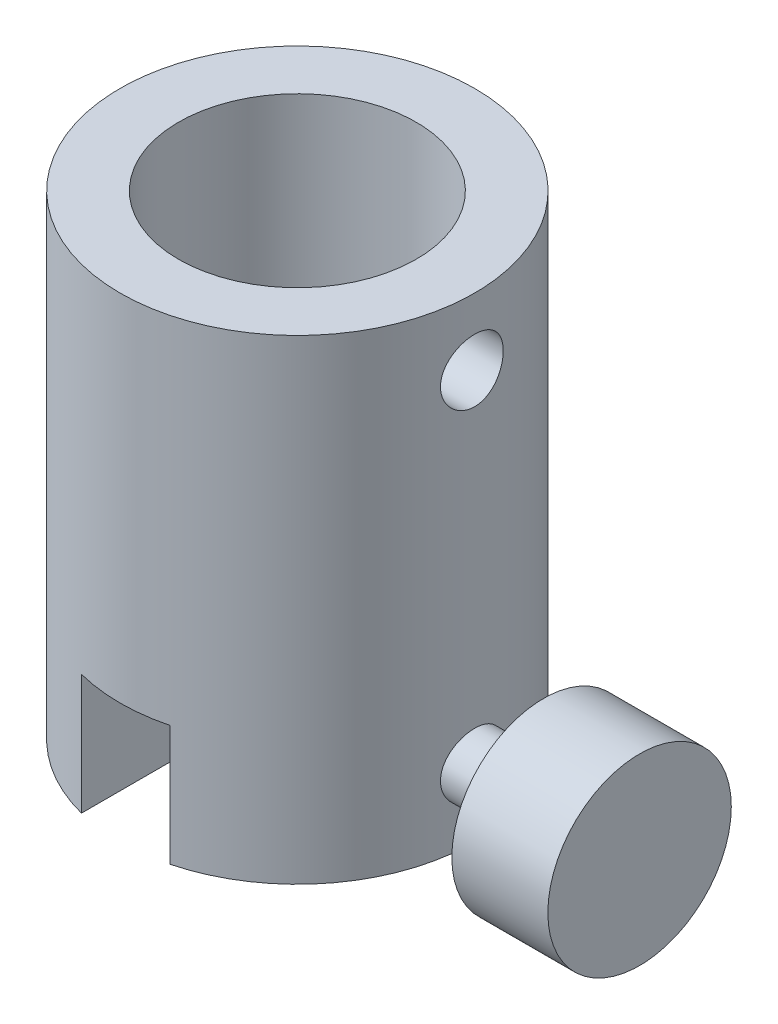
from build123d import *

# Parameters (mm, degrees)
SKETCH1_R               = 9.4742
BOSS_EXTRUDE1_DEPTH     = 25.4
SKETCH2_R               = 6.35
CUT_EXTRUDE1_DEPTH      = 15.9766
CUT_EXTRUDE2_DEPTH      = 29.717258422
CUT_EXTRUDE2_DEPTH_BACK = 29.717258422
CUT_EXTRUDE3_DEPTH      = 29.717258422
CUT_EXTRUDE3_DEPTH_BACK = 29.717258422
SKETCH4_R               = 1.6764
SKETCH5_R               = 1.6764
CUT_EXTRUDE4_DEPTH      = 29.717258577
SKETCH6_R               = 1.6764
BOSS_EXTRUDE2_DEPTH     = 3.683
SKETCH7_R               = 4.9022
BOSS_EXTRUDE3_DEPTH     = 5.1308
SKETCH8_R               = 1.6764
BOSS_EXTRUDE4_DEPTH     = 6.5278


with BuildPart() as part:
    # Sketch1 → Boss-Extrude1 (new body)
    with BuildSketch(Plane(origin=(0, 0, 0), x_dir=(1, 0, 0), z_dir=(0, 1, 0))):
        with Locations(Location((0, 0, 0), (0, 0, 270))):
            Circle(SKETCH1_R)
    extrude(amount=BOSS_EXTRUDE1_DEPTH)

    # Sketch2 → Cut-Extrude1 (cut)
    with BuildSketch(Plane(origin=(0, 25.4, 0), x_dir=(1, 0, 0), z_dir=(0, 1, 0))):
        with Locations(Location((0, 0, 0), (0, 0, 270))):
            Circle(SKETCH2_R)
    extrude(amount=-CUT_EXTRUDE1_DEPTH, mode=Mode.SUBTRACT)

    # Sketch3 → Cut-Extrude2 (cut, two sides: drawn at the far end of the back side and taken through both)
    with BuildSketch(Plane.XY.offset(-CUT_EXTRUDE2_DEPTH_BACK)):
        Polygon((0, 0), (2.3622, 0), (2.3622, 6.4262), (-2.3622, 6.4262), (-2.3622, 0), align=None)
    extrude(amount=CUT_EXTRUDE2_DEPTH + CUT_EXTRUDE2_DEPTH_BACK, mode=Mode.SUBTRACT)

    # Sketch4 → Cut-Extrude3 (cut, two sides: drawn at the far end of the back side and taken through both)
    with BuildSketch(Plane(origin=(0, 0, 0), x_dir=(0, 0, -1), z_dir=(1, 0, 0)).offset(-CUT_EXTRUDE3_DEPTH_BACK)):
        with Locations((0, 3.5814)):
            Circle(SKETCH4_R)
    extrude(amount=CUT_EXTRUDE3_DEPTH + CUT_EXTRUDE3_DEPTH_BACK, mode=Mode.SUBTRACT)

    # Sketch5 → Cut-Extrude4 (cut, through all)
    with BuildSketch(Plane(origin=(0, 0, 0), x_dir=(0, 0, -1), z_dir=(1, 0, 0))):
        with Locations(Location((0, 21.8186, 0), (0, 0, 180))):
            Circle(SKETCH5_R)
    extrude(amount=CUT_EXTRUDE4_DEPTH, mode=Mode.SUBTRACT)



with BuildPart() as body_2:
    # Sketch6 → Boss-Extrude2 (new body)
    with BuildSketch(Plane(origin=(9.4742, 0, 0), x_dir=(0, 0, -1), z_dir=(1, 0, 0))):
        with Locations((0, 3.5814)):
            Circle(SKETCH6_R)
    extrude(amount=BOSS_EXTRUDE2_DEPTH)

    # Sketch7 → Boss-Extrude3 (add)
    with BuildSketch(Plane(origin=(13.1572, 0, 0), x_dir=(0, 0, -1), z_dir=(1, 0, 0))):
        with Locations((0, 3.5814)):
            Circle(SKETCH7_R)
    extrude(amount=BOSS_EXTRUDE3_DEPTH)


with BuildPart() as part_1:
    add(part.part)

    add(body_2.part)  # Boss-Extrude4 merges body 2
    # Sketch8 → Boss-Extrude4 (add)
    with BuildSketch(Plane(origin=(9.4742, 0, 0), x_dir=(0, 0, -1), z_dir=(1, 0, 0))):
        with Locations((0, 3.5814)):
            Circle(SKETCH8_R)
    extrude(amount=-BOSS_EXTRUDE4_DEPTH)


solid = part_1.part
